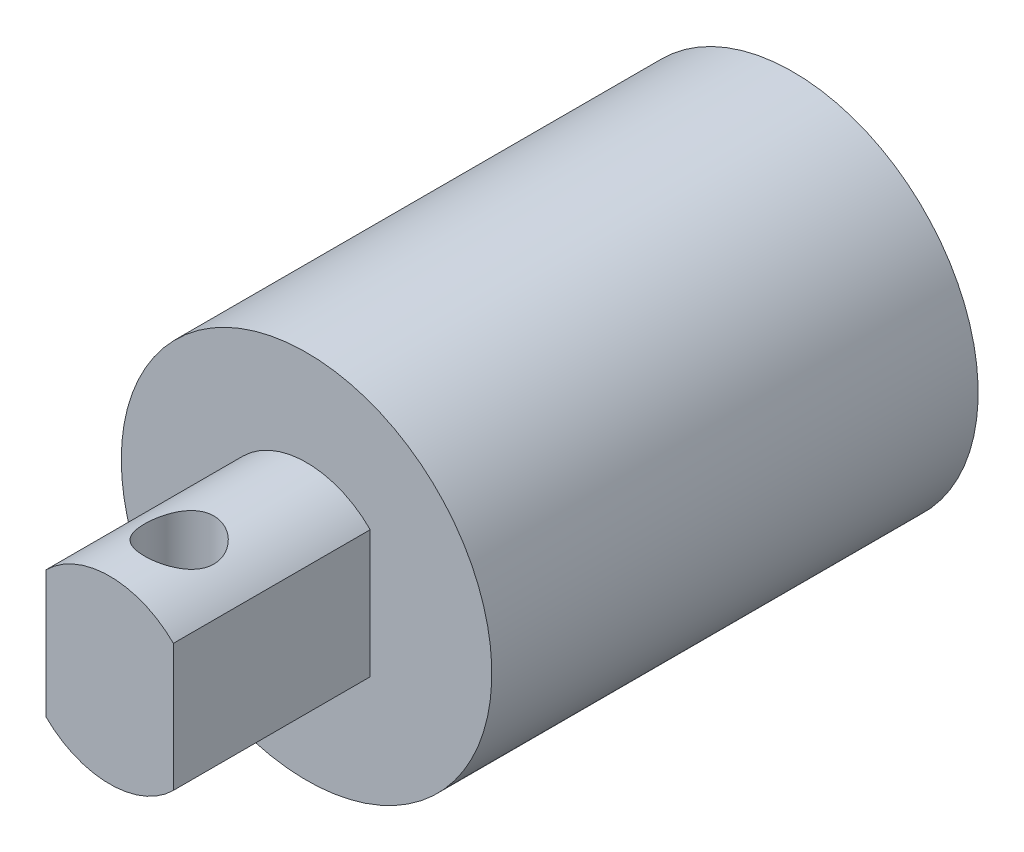
from build123d import *

# Parameters (mm, degrees)
SKETCH1_R           = 8
BOSS_EXTRUDE1_DEPTH = 21
SKETCH2_W           = 2.5
SKETCH2_H           = 9
CUT_EXTRUDE1_DEPTH  = 10
SKETCH3_R           = 2
CUT_EXTRUDE2_DEPTH  = 2
BOSS_EXTRUDE2_DEPTH = 8.5
SKETCH5_R           = 1.5
CUT_EXTRUDE3_DEPTH  = 4.25


with BuildPart() as part:
    # Sketch1 → Boss-Extrude1 (new body)
    with BuildSketch(Plane.XY):
        with Locations(Location((0, 0, 0), (0, 0, 180))):
            Circle(SKETCH1_R)
    extrude(amount=BOSS_EXTRUDE1_DEPTH)

    # Sketch2 → Cut-Extrude1 (cut)
    with BuildSketch(Plane(origin=(0, 0, 0), x_dir=(-1, 0, 0), z_dir=(0, 0, -1))):
        with Locations((0, -1.5)):
            Rectangle(SKETCH2_W, SKETCH2_H)
    extrude(amount=-CUT_EXTRUDE1_DEPTH, mode=Mode.SUBTRACT)

    # Sketch3 → Cut-Extrude2 (cut)
    with BuildSketch(Plane(origin=(0, 0, 0), x_dir=(-1, 0, 0), z_dir=(0, 0, -1))):
        Circle(SKETCH3_R)
    extrude(amount=-CUT_EXTRUDE2_DEPTH, mode=Mode.SUBTRACT)

    # Sketch4 → Boss-Extrude2 (add)
    with BuildSketch(Plane.XY.offset(21)):
        with BuildLine():
            Line((-2.75, 2.75), (-2.75, -2.75))
            ThreePointArc((-2.75, -2.75), (0, -3.889087297), (2.75, -2.75))
            Line((2.75, -2.75), (2.75, 2.75))
            ThreePointArc((2.75, 2.75), (0, 3.889087297), (-2.75, 2.75))
        make_face()
    extrude(amount=BOSS_EXTRUDE2_DEPTH)

    # Sketch5 → Cut-Extrude3 (cut, symmetric)
    with BuildSketch(Plane(origin=(0, 0, 0), x_dir=(1, 0, 0), z_dir=(0, 1, 0))):
        with Locations(Location((0, -26.5, 0), (0, 0, 270))):
            Circle(SKETCH5_R)
    extrude(amount=CUT_EXTRUDE3_DEPTH, both=True, mode=Mode.SUBTRACT)


solid = part.part
